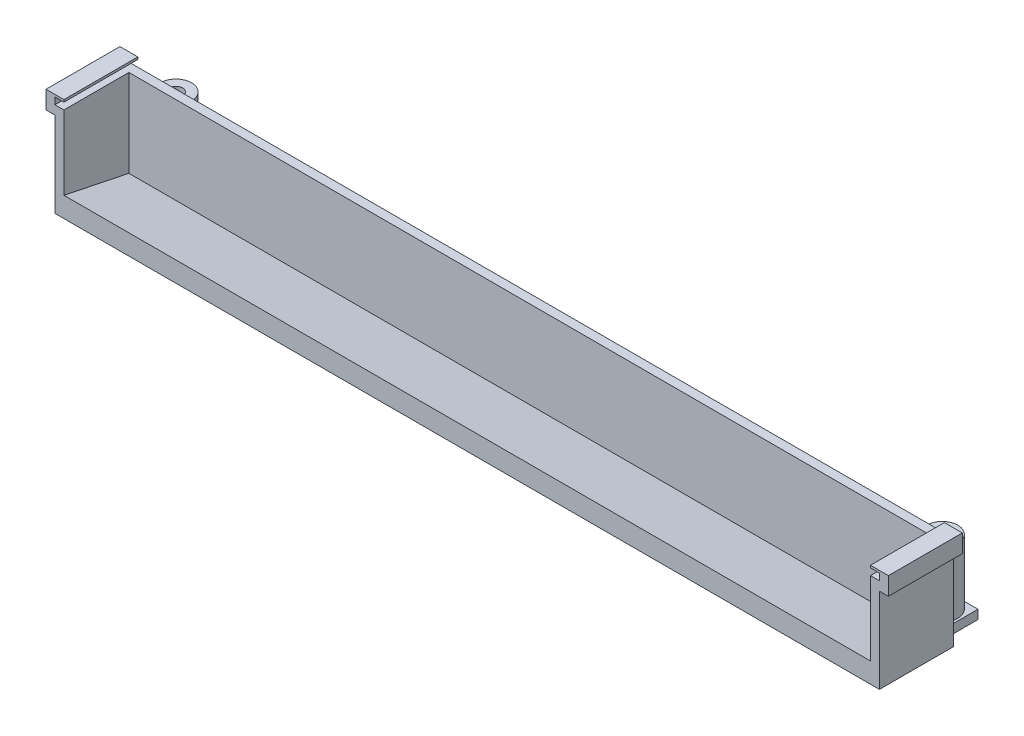
from build123d import *

# Parameters (mm, degrees)
SKIZZE1_W                        = 180
SKIZZE1_H                        = 14.5
AUFSATZ_LINEAR_AUSTRAGEN1_DEPTH  = 4.5
SCHNITT_LINEAR_AUSTRAGEN2_DEPTH  = 181.202143439
SKIZZE4_W                        = 180
SKIZZE4_H                        = 2
AUFSATZ_LINEAR_AUSTRAGEN2_DEPTH  = 21
SKIZZE5_W                        = 8
SKIZZE5_H                        = 8
AUFSATZ_LINEAR_AUSTRAGEN3_DEPTH  = 2
SKIZZE6_R                        = 3.5
AUFSATZ_LINEAR_AUSTRAGEN4_DEPTH  = 14.5
SKIZZE7_R                        = 1.5
SCHNITT_LINEAR_AUSTRAGEN3_DEPTH  = 10
SKIZZE8_W                        = 16.5
SKIZZE8_H                        = 2
AUFSATZ_LINEAR_AUSTRAGEN5_DEPTH  = 2
SKIZZE9_W                        = 2
SKIZZE9_H                        = 16.5
AUFSATZ_LINEAR_AUSTRAGEN6_DEPTH  = 2
SKIZZE10_W                       = 16.5
SKIZZE10_H                       = 0.5
AUFSATZ_LINEAR_AUSTRAGEN7_DEPTH  = 2
SKIZZE11_W                       = 16.5
SKIZZE11_H                       = 2
AUFSATZ_LINEAR_AUSTRAGEN8_DEPTH  = 2
SKIZZE12_W                       = 2
SKIZZE12_H                       = 16.5
AUFSATZ_LINEAR_AUSTRAGEN9_DEPTH  = 2
SKIZZE13_W                       = 16.5
SKIZZE13_H                       = 0.498323608
AUFSATZ_LINEAR_AUSTRAGEN10_DEPTH = 2


with BuildPart() as part:
    # Skizze1 → Aufsatz-Linear austragen1 (new body)
    with BuildSketch(Plane(origin=(0, 0, 0), x_dir=(1, 0, 0), z_dir=(0, 1, 0))):
        Rectangle(SKIZZE1_W, SKIZZE1_H)
    extrude(amount=AUFSATZ_LINEAR_AUSTRAGEN1_DEPTH)

    # Skizze2 → Schnitt-Linear austragen2 (cut, through all)
    with BuildSketch(Plane.ZY.offset(90)):
        Polygon((-7.25, 4.5), (-7.25, 1.5), (7.25, 4.5), align=None)
    extrude(amount=-SCHNITT_LINEAR_AUSTRAGEN2_DEPTH, mode=Mode.SUBTRACT)

    # Skizze4 → Aufsatz-Linear austragen2 (add)
    with BuildSketch(Plane(origin=(0, 0, 0), x_dir=(1, 0, 0), z_dir=(0, 1, 0))):
        with Locations((0, 8.25)):
            Rectangle(SKIZZE4_W, SKIZZE4_H)
        Polygon((90, 9.25), (90, 7.25), (90, -7.25), (92, -7.25), (92, 9.25), align=None)
        Polygon((-90, -7.25), (-90, 7.25), (-90, 9.25), (-92, 9.25), (-92, -7.25), align=None)
    extrude(amount=AUFSATZ_LINEAR_AUSTRAGEN2_DEPTH)

    # Skizze5 → Aufsatz-Linear austragen3 (add)
    with BuildSketch(Plane(origin=(0, 0, 0), x_dir=(1, 0, 0), z_dir=(0, 1, 0))):
        with Locations((-85.5, 13.25)):
            Rectangle(SKIZZE5_W, SKIZZE5_H)
        with Locations((85.5, 13.25)):
            Rectangle(SKIZZE5_W, SKIZZE5_H)
    extrude(amount=AUFSATZ_LINEAR_AUSTRAGEN3_DEPTH)

    # Skizze6 → Aufsatz-Linear austragen4 (add)
    with BuildSketch(Plane(origin=(0, 2, 0), x_dir=(1, 0, 0), z_dir=(0, 1, 0))):
        with Locations(Location((-85.5, 13.25, 0), (0, 0, 90))):
            Circle(SKIZZE6_R)
        with Locations(Location((85.5, 13.25, 0), (0, 0, 90))):
            Circle(SKIZZE6_R)
    extrude(amount=AUFSATZ_LINEAR_AUSTRAGEN4_DEPTH)

    # Skizze7 → Schnitt-Linear austragen3 (cut)
    with BuildSketch(Plane(origin=(0, 16.5, 0), x_dir=(1, 0, 0), z_dir=(0, 1, 0))):
        with Locations(Location((85.5, 13.25, 0), (0, 0, 270))):
            Circle(SKIZZE7_R)
        with Locations(Location((-85.5, 13.25, 0), (0, 0, 270))):
            Circle(SKIZZE7_R)
    extrude(amount=-SCHNITT_LINEAR_AUSTRAGEN3_DEPTH, mode=Mode.SUBTRACT)

    # Skizze8 → Aufsatz-Linear austragen5 (add)
    with BuildSketch(Plane(origin=(92, 0, 0), x_dir=(0, 0, -1), z_dir=(1, 0, 0))):
        with Locations((1, 20)):
            Rectangle(SKIZZE8_W, SKIZZE8_H)
    extrude(amount=AUFSATZ_LINEAR_AUSTRAGEN5_DEPTH)

    # Skizze9 → Aufsatz-Linear austragen6 (add)
    with BuildSketch(Plane(origin=(0, 21, 0), x_dir=(1, 0, 0), z_dir=(0, 1, 0))):
        with Locations((93, 1)):
            Rectangle(SKIZZE9_W, SKIZZE9_H)
    extrude(amount=AUFSATZ_LINEAR_AUSTRAGEN6_DEPTH)

    # Skizze10 → Aufsatz-Linear austragen7 (add)
    with BuildSketch(Plane.ZY.offset(-92)):
        with Locations((-1, 22.75)):
            Rectangle(SKIZZE10_W, SKIZZE10_H)
    extrude(amount=AUFSATZ_LINEAR_AUSTRAGEN7_DEPTH)

    # Skizze11 → Aufsatz-Linear austragen8 (add)
    with BuildSketch(Plane.ZY.offset(92)):
        with Locations((-1, 20)):
            Rectangle(SKIZZE11_W, SKIZZE11_H)
    extrude(amount=AUFSATZ_LINEAR_AUSTRAGEN8_DEPTH)

    # Skizze12 → Aufsatz-Linear austragen9 (add)
    with BuildSketch(Plane(origin=(0, 21, 0), x_dir=(1, 0, 0), z_dir=(0, 1, 0))):
        with Locations((-93, 1)):
            Rectangle(SKIZZE12_W, SKIZZE12_H)
    extrude(amount=AUFSATZ_LINEAR_AUSTRAGEN9_DEPTH)

    # Skizze13 → Aufsatz-Linear austragen10 (add)
    with BuildSketch(Plane(origin=(-92, 0, 0), x_dir=(0, 0, -1), z_dir=(1, 0, 0))):
        with Locations((1, 22.750838196)):
            Rectangle(SKIZZE13_W, SKIZZE13_H)
    extrude(amount=AUFSATZ_LINEAR_AUSTRAGEN10_DEPTH)


solid = part.part
